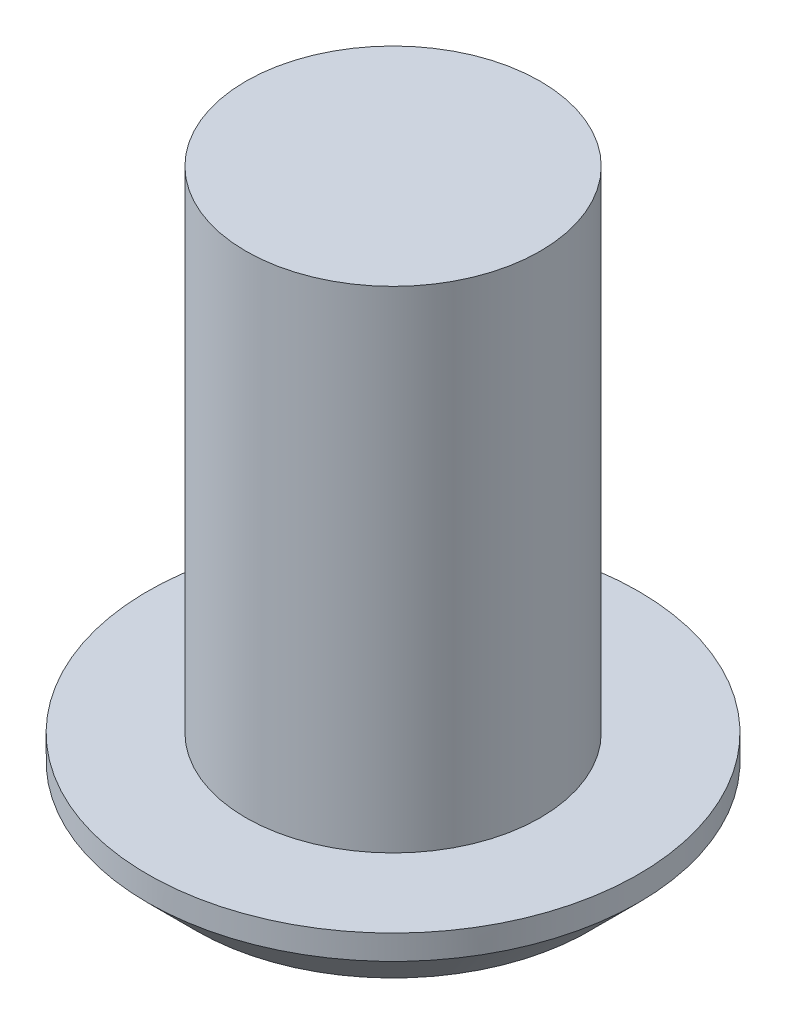
from build123d import *

# Parameters (mm, degrees)
SKETCH1_W     = 10
SKETCH1_H     = 3
CHAMFER1_SIZE = 1


with BuildPart() as part:
    # Sketch1 → Revolve1 (revolve)
    with BuildSketch(Plane.YZ, mode=Mode.PRIVATE) as revolve1_sk:
        Polygon((-1.5, 0), (0, 0), (0, 3), (0, 5), (-1.5, 5), align=None)
        with Locations((5, 1.5)):
            Rectangle(SKETCH1_W, SKETCH1_H)
    revolve(revolve1_sk.sketch.rotate(Axis((0, -2.301426894, 0), (0, 1, 0)), 180), axis=Axis((0, -2.301426894, 0), (0, 1, 0)))

    # Chamfer1
    chamfer1_edges = [part.edges().sort_by_distance(p)[0] for p in [
        (0, -1.5, 5),
    ]]
    chamfer(chamfer1_edges, length=CHAMFER1_SIZE)


solid = part.part
